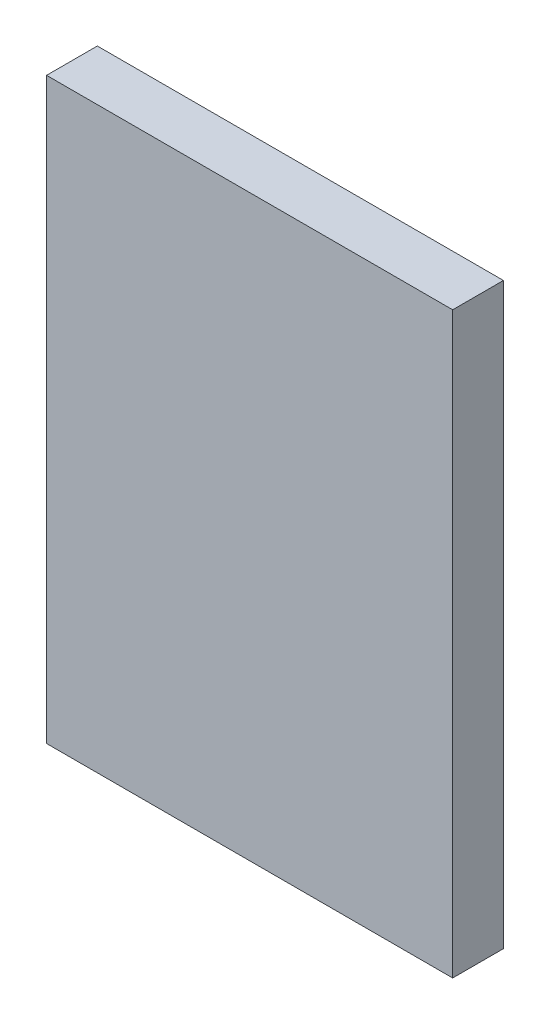
from build123d import *

# Parameters (mm, degrees)
SKETCH_1_W      = 40
SKETCH_1_H      = 57
EXTRUDE_1_DEPTH = 5


with BuildPart() as part:
    # Эскиз1 → Бобышка-Вытянуть1 (new body)
    with BuildSketch(Plane.XY):
        Rectangle(SKETCH_1_W, SKETCH_1_H)
    extrude(amount=-EXTRUDE_1_DEPTH)


solid = part.part
